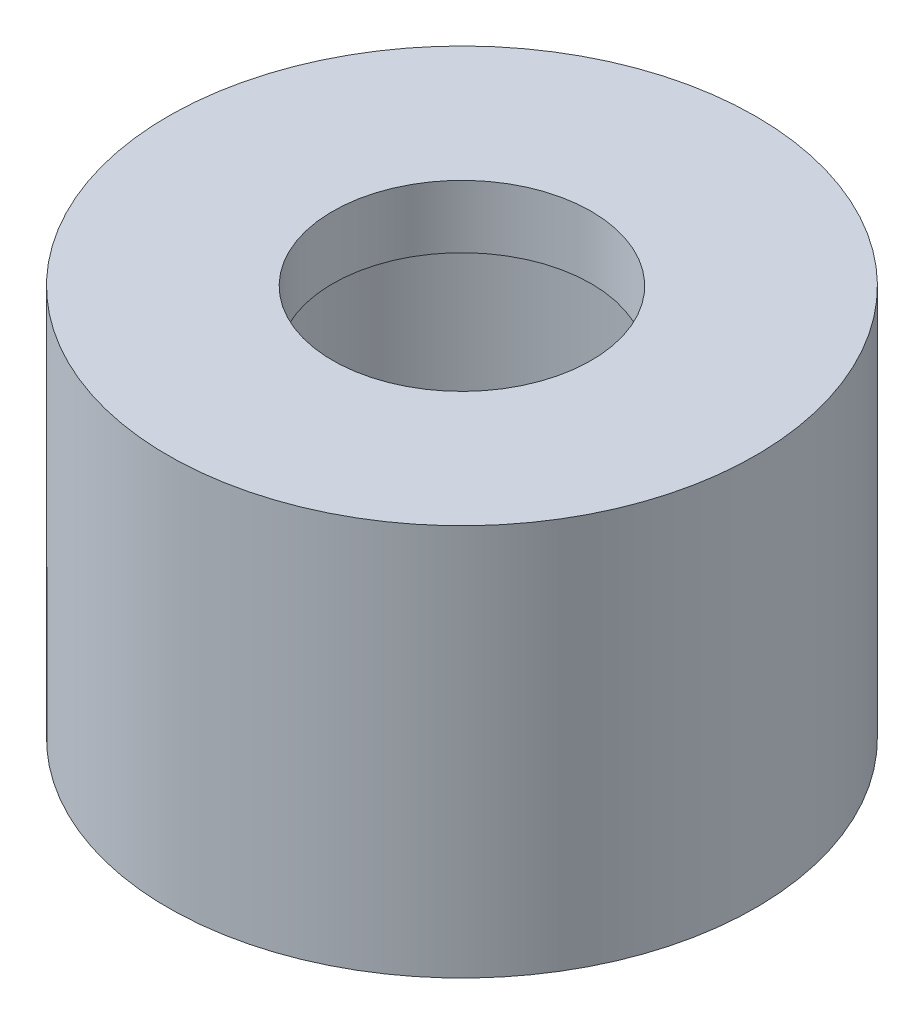
from build123d import *


with BuildPart() as part:
    # Szkic1 → Obrót1 (revolve)
    with BuildSketch(Plane.XY):
        Polygon((-3.3, 12.658437775), (-7.5, 12.658437775), (-7.5, 2.658437775), (-5.5, 2.658437775), (-5.5, 11.058437775), (-3.3, 11.058437775), align=None)
    revolve(axis=Axis((0, 0, 0), (0, 1, 0)))


solid = part.part
